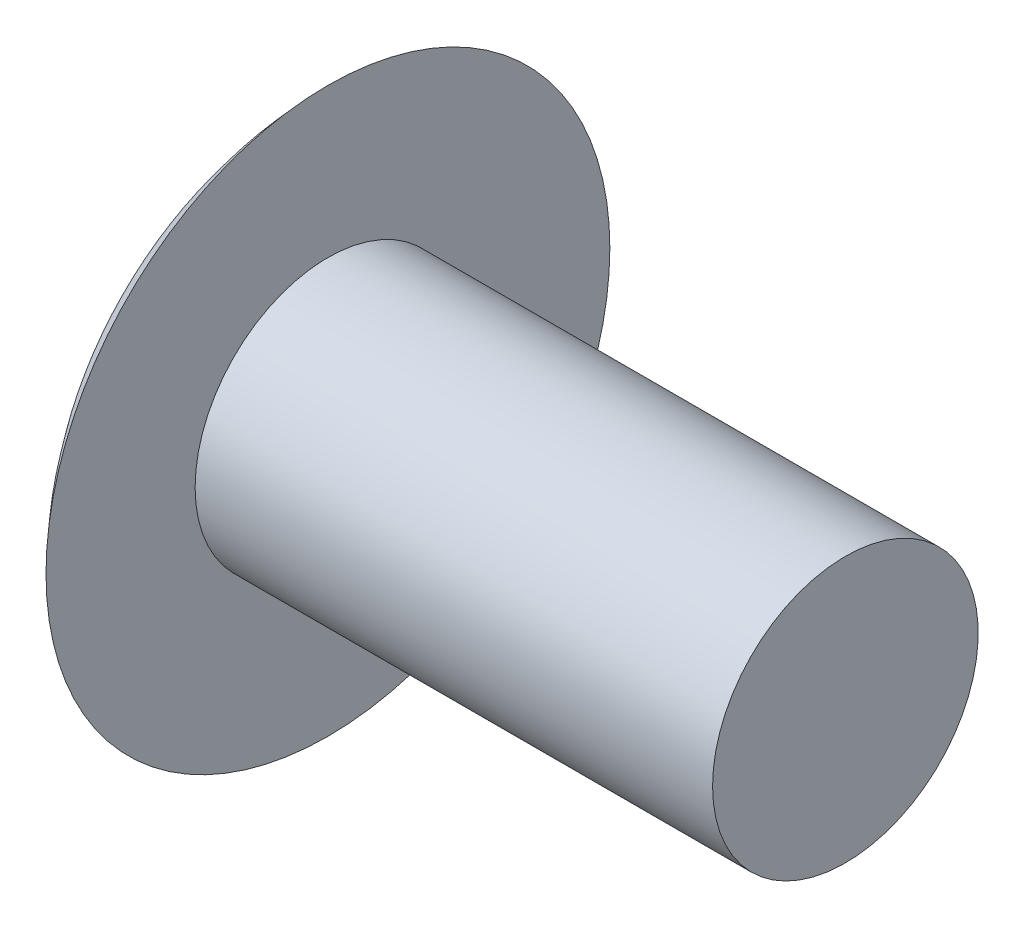
from build123d import *


with BuildPart() as part:
    # 草图1 → 旋转1 (revolve)
    with BuildSketch(Plane(origin=(0, 0, 0), x_dir=(1, 0, 0), z_dir=(0, 1, 0)), mode=Mode.PRIVATE) as revolve_1_sk:
        with BuildLine():
            Line((25, -3.268964269), (25, -1.54))
            Line((25, -1.54), (31, -1.54))
            Line((31, -1.54), (31, 0))
            Line((31, 0), (23.7, 0))
            ThreePointArc((23.7, 0), (24.036924015, -1.758986028), (25, -3.268964269))
        make_face()
    revolve(revolve_1_sk.sketch.rotate(Axis((0, 0, 0), (1, 0, 0)), 180), axis=Axis((0, 0, 0), (1, 0, 0)))


solid = part.part
